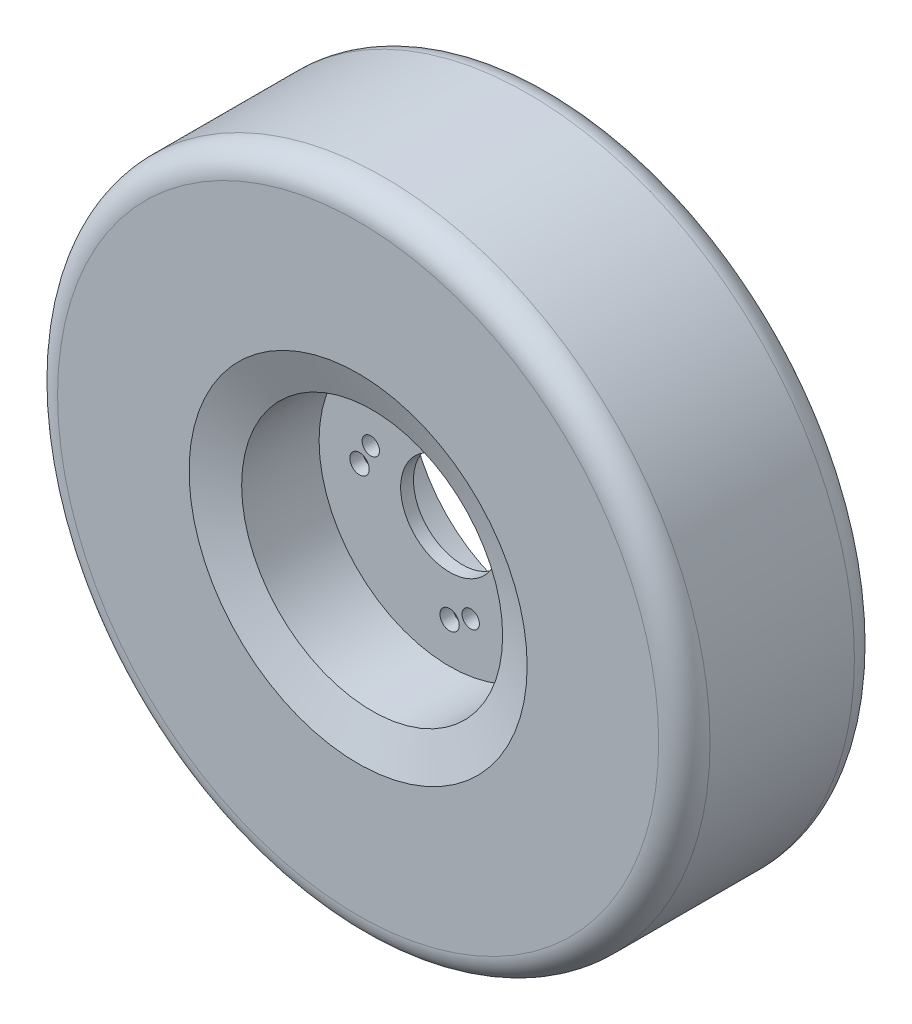
from build123d import *
from OCP.BRepFilletAPI import BRepFilletAPI_MakeChamfer

# Parameters (mm, degrees)
SKETCH1_R                            = 127
SKETCH1_R_2                          = 50.8
BOSS_EXTRUDE1_DEPTH                  = 38.1
CHAMFER1_SIZE                        = 15
CHAMFER1_SIZE2                       = 5.459553514
FILLET1_R                            = 10
SKETCH2_R                            = 50.8
SKETCH2_R_2                          = 19.05
BOSS_EXTRUDE2_DEPTH                  = 2.5
F_19_64_0_29688_DIAMETER_HOLE1_D     = 7.540752
F_19_64_0_29688_DIAMETER_HOLE1_DEPTH = 18.75
F_19_64_0_29688_DIAMETER_HOLE1_TIP   = 2.265470457
F_1_4_CLEARANCE_HOLE1_D              = 6.7564
F_1_4_CLEARANCE_HOLE1_DEPTH          = 18.75
F_1_4_CLEARANCE_HOLE1_TIP            = 2.029827343


with BuildPart() as part:
    # Sketch1 → Boss-Extrude1 (new, symmetric)
    with BuildSketch(Plane.XY):
        with Locations(Location((0, 0, 0), (0, 0, 180))):
            Circle(SKETCH1_R)
        with Locations(Location((0, 0, 0), (0, 0, 180))):
            Circle(SKETCH1_R_2, mode=Mode.SUBTRACT)
    extrude(amount=BOSS_EXTRUDE1_DEPTH, both=True)

    # Chamfer1: one chamfer whose edges measure the first distance from different faces: ONE call of the kernel's chamfer builder (chamfer() names one face for all edges)
    chamfer1_edges_1 = [part.edges().sort_by_distance(p)[0] for p in [
        (50.8, 0, -38.1),
    ]]
    chamfer1_side_1 = [part.faces().sort_by_distance(p)[0] for p in [
        (123.407897552, 0, -38.1),
    ]]
    chamfer1_edges_2 = [part.edges().sort_by_distance(p)[0] for p in [
        (50.8, 0, 38.1),
    ]]
    chamfer1_side_2 = [part.faces().sort_by_distance(p)[0] for p in [
        (123.407897552, 0, 38.1),
    ]]
    chamfer1 = BRepFilletAPI_MakeChamfer(part.part.solid().wrapped)
    for e in chamfer1_edges_1:
        chamfer1.Add(CHAMFER1_SIZE, CHAMFER1_SIZE2, e.wrapped, chamfer1_side_1[0].wrapped)  # the first distance lies on this face
    for e in chamfer1_edges_2:
        chamfer1.Add(CHAMFER1_SIZE, CHAMFER1_SIZE2, e.wrapped, chamfer1_side_2[0].wrapped)  # the first distance lies on this face
    add(Compound.cast(chamfer1.Shape()), mode=Mode.REPLACE)

    # Fillet1
    fillet1_edges = [part.edges().sort_by_distance(p)[0] for p in [
        (127, 0, -38.1),
        (127, 0, 38.1),
    ]]
    fillet(fillet1_edges, radius=FILLET1_R)

    # Sketch2 → Boss-Extrude2 (add, symmetric)
    with BuildSketch(Plane.XY):
        with Locations(Location((0, 0, 0), (0, 0, 180))):
            Circle(SKETCH2_R)
        Circle(SKETCH2_R_2, mode=Mode.SUBTRACT)
    extrude(amount=BOSS_EXTRUDE2_DEPTH, both=True)

    # 19/64 (0.29688) Diameter Hole1
    with Locations(Plane.XY.offset(2.5)):
        with Locations((0, 35.052), (35.052, 0), (0, -35.052), (-35.052, 0)):
            Hole(F_19_64_0_29688_DIAMETER_HOLE1_D / 2, depth=F_19_64_0_29688_DIAMETER_HOLE1_DEPTH)
            with Locations((0, 0, -(F_19_64_0_29688_DIAMETER_HOLE1_DEPTH + F_19_64_0_29688_DIAMETER_HOLE1_TIP / 2))):  # 118° drill point
                Cone(0, F_19_64_0_29688_DIAMETER_HOLE1_D / 2, F_19_64_0_29688_DIAMETER_HOLE1_TIP, mode=Mode.SUBTRACT)

    # 1/4 Clearance Hole1
    with Locations(Plane.XY.offset(2.5)):
        with Locations((-30.668144985, 8.217504682), (22.450640303, 22.450640303), (8.217504682, -30.668144985)):
            Hole(F_1_4_CLEARANCE_HOLE1_D / 2, depth=F_1_4_CLEARANCE_HOLE1_DEPTH)
            with Locations((0, 0, -(F_1_4_CLEARANCE_HOLE1_DEPTH + F_1_4_CLEARANCE_HOLE1_TIP / 2))):  # 118° drill point
                Cone(0, F_1_4_CLEARANCE_HOLE1_D / 2, F_1_4_CLEARANCE_HOLE1_TIP, mode=Mode.SUBTRACT)


solid = part.part
